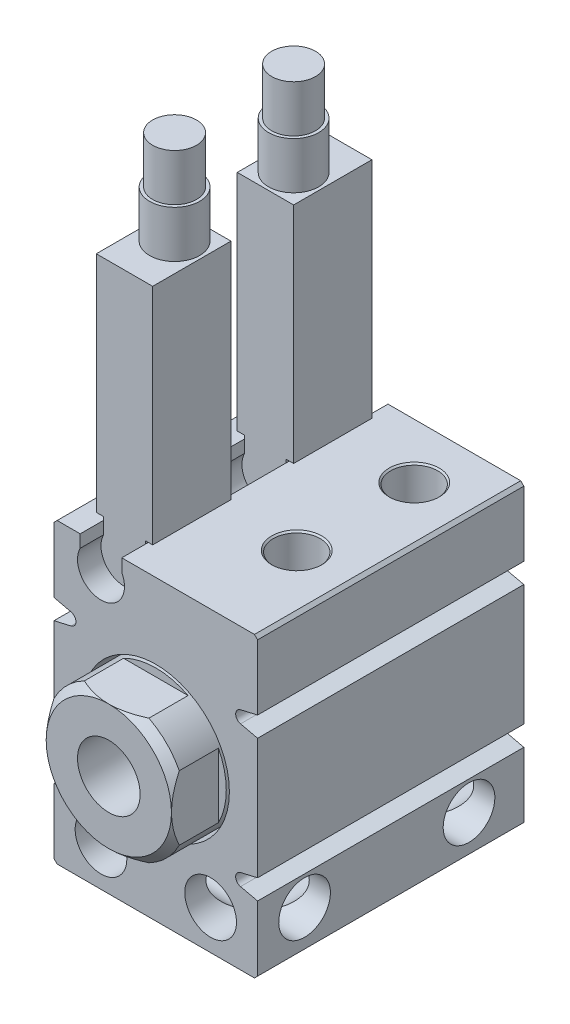
from build123d import *

# Parameters (mm, degrees)
EXTRUDE_START         = 8.5
SKETCH_20_R           = 1.65
EXTRUDE_3_DEPTH       = 17
SKETCH_21_R           = 4.7
CUT_EXTRUDE_7_DEPTH   = 2.5
CUT_EXTRUDE_8_REACH   = 20.207
SKETCH_22_R           = 1.65
SKETCH_23_R           = 1.5
CUT_EXTRUDE_9_DEPTH   = 3
CHAMFER_4_SIZE        = 0.1
CHAMFER_5_SIZE        = 0.2
SKETCH_24_W           = 16
SKETCH_24_H           = 3
SKETCH_25_R           = 4.5
SKETCH_25_R_2         = 2
EXTRUDE_4_DEPTH       = 5.5
CHAMFER_6_SIZE        = 0.5
SKETCH_26_OUTSIDE_W   = 21.1
SKETCH_26_OUTSIDE_H   = 27.1
SKETCH_26_OUTSIDE_W_2 = 8
SKETCH_26_OUTSIDE_H_2 = 8
CUT_EXTRUDE_11_DEPTH  = 3
EXTRUDE_START_2       = 7
EXTRUDE_5_DEPTH       = 5
SKETCH_36_R           = 1.6
EXTRUDE_7_DEPTH       = 3
SKETCH_37_R           = 1.4
EXTRUDE_8_DEPTH       = 3


with BuildPart() as part:
    # 草图20 → 凸台-拉伸3 (new body)
    with BuildSketch(Plane.XY.offset(EXTRUDE_START)):
        with BuildLine():
            Line((-6.5, 9.5), (-6.5, 5.141389834))
            Line((-6.5, 5.141389834), (-5.410019578, 4.889748026))
            ThreePointArc((-5.410019578, 4.889748026), (-5.1, 4.5), (-5.410019578, 4.110251974))
            Line((-5.410019578, 4.110251974), (-6.5, 3.858610166))
            Line((-6.5, 3.858610166), (-6.5, -3.858610166))
            Line((-6.5, -3.858610166), (-5.410019578, -4.110251974))
            ThreePointArc((-5.410019578, -4.110251974), (-5.1, -4.5), (-5.410019578, -4.889748026))
            Line((-5.410019578, -4.889748026), (-6.5, -5.141389834))
            Line((-6.5, -5.141389834), (-6.5, -9.5))
            Line((-6.5, -9.5), (6.5, -9.5))
            Line((6.5, -9.5), (6.5, -5.141389834))
            Line((6.5, -5.141389834), (5.410019578, -4.889748026))
            ThreePointArc((5.410019578, -4.889748026), (5.1, -4.5), (5.410019578, -4.110251974))
            Line((5.410019578, -4.110251974), (6.5, -3.858610166))
            Line((6.5, -3.858610166), (6.5, 3.858610166))
            Line((6.5, 3.858610166), (5.410019578, 4.110251974))
            ThreePointArc((5.410019578, 4.110251974), (5.1, 4.5), (5.410019578, 4.889748026))
            Line((5.410019578, 4.889748026), (6.5, 5.141389834))
            Line((6.5, 5.141389834), (6.5, 9.5))
            Line((6.5, 9.5), (-2.173350084, 9.5))
            Line((-2.173350084, 9.5), (-2.173350084, 8.7))
            ThreePointArc((-2.173350084, 8.7), (-3.5, 6.5), (-4.826649916, 8.7))
            Line((-4.826649916, 8.7), (-4.826649916, 9.5))
            Line((-4.826649916, 9.5), (-6.5, 9.5))
        make_face()
        with Locations((-3.5, -7)):
            Circle(SKETCH_20_R, mode=Mode.SUBTRACT)
        with Locations((3.5, -7)):
            Circle(SKETCH_20_R, mode=Mode.SUBTRACT)
    extrude(amount=-EXTRUDE_3_DEPTH)

    # 草图21 → 切除-拉伸7 (cut)
    with BuildSketch(Plane.XY.offset(8.5)):
        Circle(SKETCH_21_R)
    extrude(amount=-CUT_EXTRUDE_7_DEPTH, mode=Mode.SUBTRACT)

    # 切除-拉伸8: up to this face of the body (flat: up to its plane)
    cut_extrude_8_end = Plane(part.part.faces().sort_by_distance((-6.5, -7.320694917, 0))[0])
    # 草图22 → 切除-拉伸8 (cut, up to the picked face)
    with BuildSketch(Plane(origin=(6.5, 0, 0), x_dir=(0, 0, -1), z_dir=(1, 0, 0)), mode=Mode.PRIVATE) as cut_extrude_8_sk1:
        with Locations(Location((-5.5, -7, 0), (0, 0, 90))):
            Circle(SKETCH_22_R)
    cut_extrude_8_tool1 = split(extrude(cut_extrude_8_sk1.sketch, amount=-CUT_EXTRUDE_8_REACH, mode=Mode.PRIVATE), bisect_by=cut_extrude_8_end, keep=Keep.BOTH, mode=Mode.PRIVATE)
    # 草图22 → 切除-拉伸8 (cut, up to the picked face)
    with BuildSketch(Plane(origin=(6.5, 0, 0), x_dir=(0, 0, -1), z_dir=(1, 0, 0)), mode=Mode.PRIVATE) as cut_extrude_8_sk2:
        with Locations(Location((5, -7, 0), (0, 0, 90))):
            Circle(SKETCH_22_R)
    cut_extrude_8_tool2 = split(extrude(cut_extrude_8_sk2.sketch, amount=-CUT_EXTRUDE_8_REACH, mode=Mode.PRIVATE), bisect_by=cut_extrude_8_end, keep=Keep.BOTH, mode=Mode.PRIVATE)
    add(cut_extrude_8_tool1.solids().sort_by(Axis((6.5, -7, 5.5), (-1, 0, 0)))[0], mode=Mode.SUBTRACT)
    add(cut_extrude_8_tool2.solids().sort_by(Axis((6.5, -7, -5), (-1, 0, 0)))[0], mode=Mode.SUBTRACT)

    # 草图23 → 切除-拉伸9 (cut)
    with BuildSketch(Plane(origin=(0, 9.5, 0), x_dir=(1, 0, 0), z_dir=(0, 1, 0))):
        with Locations(Location((3, -2.5, 0), (0, 0, 270))):
            Circle(SKETCH_23_R)
        with Locations(Location((3, 5, 0), (0, 0, 270))):
            Circle(SKETCH_23_R)
    extrude(amount=-CUT_EXTRUDE_9_DEPTH, mode=Mode.SUBTRACT)

    # 倒角4
    chamfer_4_edges = [part.edges().sort_by_distance(p)[0] for p in [
        (3, 9.5, 1),
        (3, 9.5, -6.5),
    ]]
    chamfer(chamfer_4_edges, length=CHAMFER_4_SIZE)

    # 倒角5
    chamfer_5_edges = [part.edges().sort_by_distance(p)[0] for p in [
        (6.5, 9.5, 0),
        (6.5, -9.5, 0),
        (-6.5, -9.5, 0),
        (-6.5, 9.5, 0),
    ]]
    chamfer(chamfer_5_edges, length=CHAMFER_5_SIZE)

    # 草图24 → 切除-旋转3 (revolve, cut)
    with BuildSketch(Plane(origin=(0, 0, 0), x_dir=(0, 0, -1), z_dir=(1, 0, 0)), mode=Mode.PRIVATE) as cut_revolve_3_sk:
        with Locations((-3.5, 1.5)):
            Rectangle(SKETCH_24_W, SKETCH_24_H)
    revolve(cut_revolve_3_sk.sketch.rotate(Axis((0, 0, 11.5), (0, 0, -1)), 90), axis=Axis((0, 0, 11.5), (0, 0, -1)), mode=Mode.SUBTRACT)

    # 草图25 → 凸台-拉伸4 (add)
    with BuildSketch(Plane.XY.offset(6)):
        Circle(SKETCH_25_R)
        Circle(SKETCH_25_R_2, mode=Mode.SUBTRACT)
    extrude(amount=EXTRUDE_4_DEPTH)

    # 倒角6
    chamfer_6_edges = [part.edges().sort_by_distance(p)[0] for p in [
        (-4.5, 0, 11.5),
    ]]
    chamfer(chamfer_6_edges, length=CHAMFER_6_SIZE)

    # 草图26 outside → 切除-拉伸11 (cut)
    with BuildSketch(Plane.XY.offset(11.5)):
        Rectangle(SKETCH_26_OUTSIDE_W, SKETCH_26_OUTSIDE_H)
        Rectangle(SKETCH_26_OUTSIDE_W_2, SKETCH_26_OUTSIDE_H_2, mode=Mode.SUBTRACT)
    extrude(amount=-CUT_EXTRUDE_11_DEPTH, mode=Mode.SUBTRACT)


with BuildPart() as body_2:
    # 草图34 → 凸台-拉伸5 (new body)
    with BuildSketch(Plane.XY.offset(EXTRUDE_START_2)):
        with BuildLine():
            Line((-4.826649916, 9.7), (-4.826649916, 8.7))
            ThreePointArc((-4.826649916, 8.7), (-3.5, 6.5), (-2.173350084, 8.7))
            Line((-2.173350084, 8.7), (-2.173350084, 9.7))
            Line((-2.173350084, 9.7), (-1.7, 9.7))
            Line((-1.7, 9.7), (-1.7, 24))
            Line((-1.7, 24), (-5.3, 24))
            Line((-5.3, 24), (-5.3, 9.7))
            Line((-5.3, 9.7), (-4.826649916, 9.7))
        make_face()
    extrude(amount=-EXTRUDE_5_DEPTH)

    # 草图36 → 凸台-拉伸7 (add)
    with BuildSketch(Plane(origin=(0, 24, 0), x_dir=(1, 0, 0), z_dir=(0, 1, 0))):
        with Locations(Location((-3.5, -3.8, 0), (0, 0, 270))):
            Circle(SKETCH_36_R)
    extrude(amount=EXTRUDE_7_DEPTH)

    # 草图37 → 凸台-拉伸8 (add)
    with BuildSketch(Plane(origin=(0, 27, 0), x_dir=(1, 0, 0), z_dir=(0, 1, 0))):
        with Locations(Location((-3.5, -3.8, 0), (0, 0, 270))):
            Circle(SKETCH_37_R)
    extrude(amount=EXTRUDE_8_DEPTH)


with BuildPart() as body_3:
    # 镜向6: mirrored copy
    add(body_2.part.mirror(Plane.XY))


solid = Compound([part.part, body_2.part, body_3.part])
